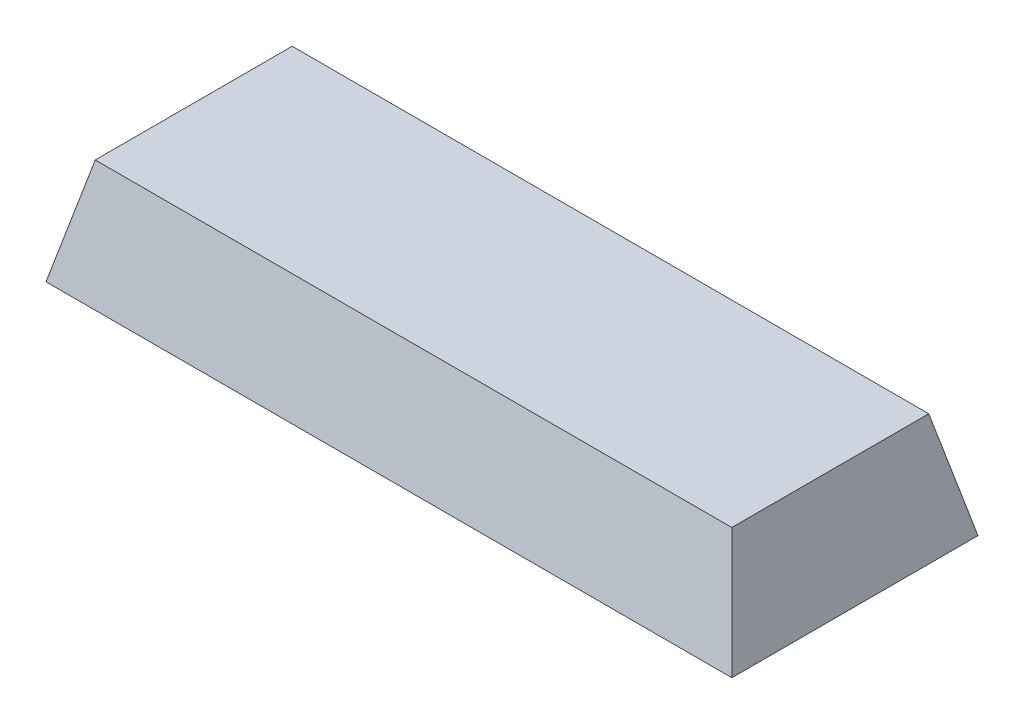
from build123d import *

# Parameters (mm, degrees)
SKETCH1_W               = 19.5
SKETCH1_H               = 7
BOSS_EXTRUDE1_DEPTH     = 3
CUT_EXTRUDE1_DEPTH      = 7
CUT_EXTRUDE2_DEPTH      = 21.934421415
CUT_EXTRUDE2_DEPTH_BACK = 21.934421415
SKETCH4_R               = 1.8
CUT_EXTRUDE3_DEPTH      = 0.8


with BuildPart() as part:
    # Sketch1 → Boss-Extrude1 (new body)
    with BuildSketch(Plane(origin=(0, 0, 0), x_dir=(1, 0, 0), z_dir=(0, 1, 0))):
        with Locations((9.75, 3.5)):
            Rectangle(SKETCH1_W, SKETCH1_H)
    extrude(amount=BOSS_EXTRUDE1_DEPTH)

    # Sketch2 → Cut-Extrude1 (cut)
    with BuildSketch(Plane.XY):
        Polygon((0, 0), (0.7, 3), (0, 3), align=None)
        Polygon((19.5, 0), (18.8, 3), (19.5, 3), align=None)
    extrude(amount=-CUT_EXTRUDE1_DEPTH, mode=Mode.SUBTRACT)

    # Sketch3 → Cut-Extrude2 (cut, two sides: drawn at the far end of the back side and taken through both)
    with BuildSketch(Plane(origin=(0, 0, 0), x_dir=(0, 0, -1), z_dir=(1, 0, 0)).offset(-CUT_EXTRUDE2_DEPTH_BACK)):
        Polygon((0, 0), (0.7, 3), (0, 3), align=None)
        Polygon((7, 3), (6.3, 3), (7, 0), align=None)
    extrude(amount=CUT_EXTRUDE2_DEPTH + CUT_EXTRUDE2_DEPTH_BACK, mode=Mode.SUBTRACT)

    # Sketch4 → Cut-Extrude3 (cut)
    with BuildSketch(Plane.XZ):
        with Locations(Location((9.75, -3.5, 0), (0, 0, 270))):
            Circle(SKETCH4_R)
    extrude(amount=-CUT_EXTRUDE3_DEPTH, mode=Mode.SUBTRACT)


solid = part.part
